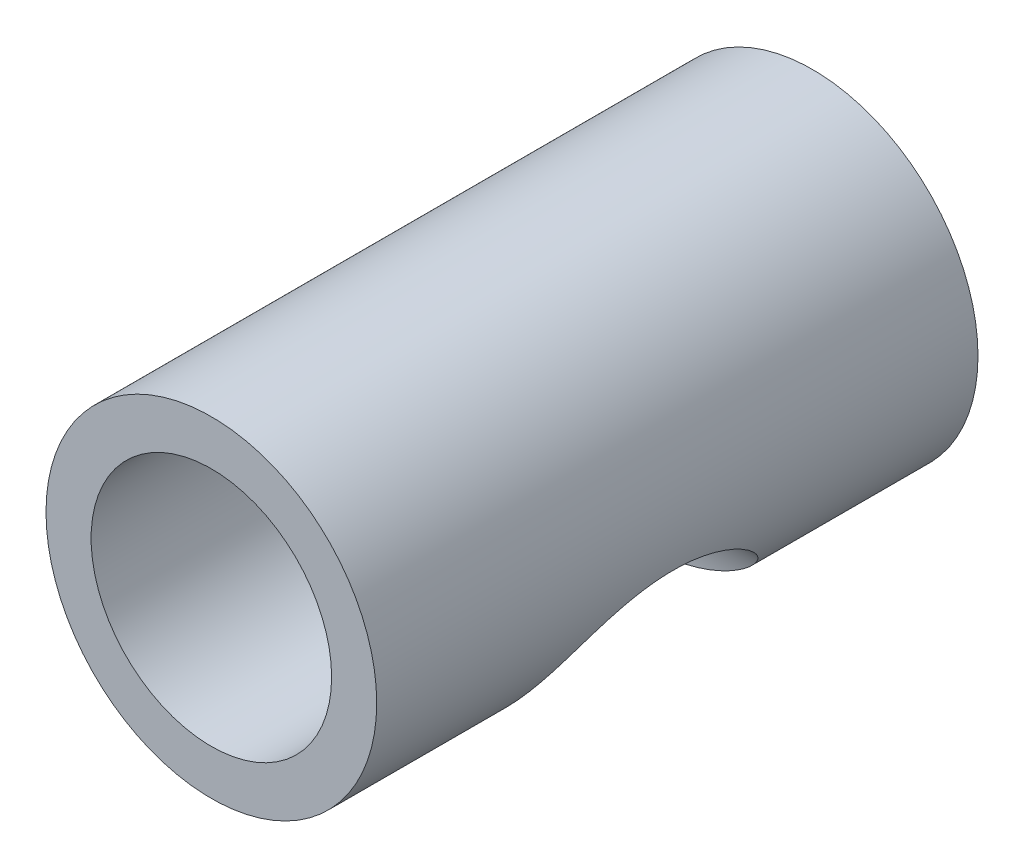
from build123d import *

# Parameters (mm, degrees)
BOSS_EXTRUDE1_DEPTH      = 40
BOSS_EXTRUDE1_DEPTH_BACK = 40
SKETCH1_R                = 22
SKETCH1_R_2              = 16
CUT_EXTRUDE1_DEPTH       = 51.675437837
CUT_EXTRUDE1_DEPTH_BACK  = 51.675437837
SKETCH2_R                = 18


with BuildPart() as part:
    # Sketch1 → Boss-Extrude1 (new, two sides: drawn at the far end of the back side and taken through both)
    with BuildSketch(Plane.XY.offset(-BOSS_EXTRUDE1_DEPTH_BACK)):
        Circle(SKETCH1_R)
        Circle(SKETCH1_R_2, mode=Mode.SUBTRACT)
    extrude(amount=BOSS_EXTRUDE1_DEPTH + BOSS_EXTRUDE1_DEPTH_BACK)

    # Sketch2 → Cut-Extrude1 (cut, two sides: drawn at the far end of the back side and taken through both)
    with BuildSketch(Plane(origin=(0, 0, 0), x_dir=(0, 0, -1), z_dir=(1, 0, 0)).offset(-CUT_EXTRUDE1_DEPTH_BACK)):
        with Locations((0, -23)):
            Circle(SKETCH2_R)
    extrude(amount=CUT_EXTRUDE1_DEPTH + CUT_EXTRUDE1_DEPTH_BACK, mode=Mode.SUBTRACT)


solid = part.part
